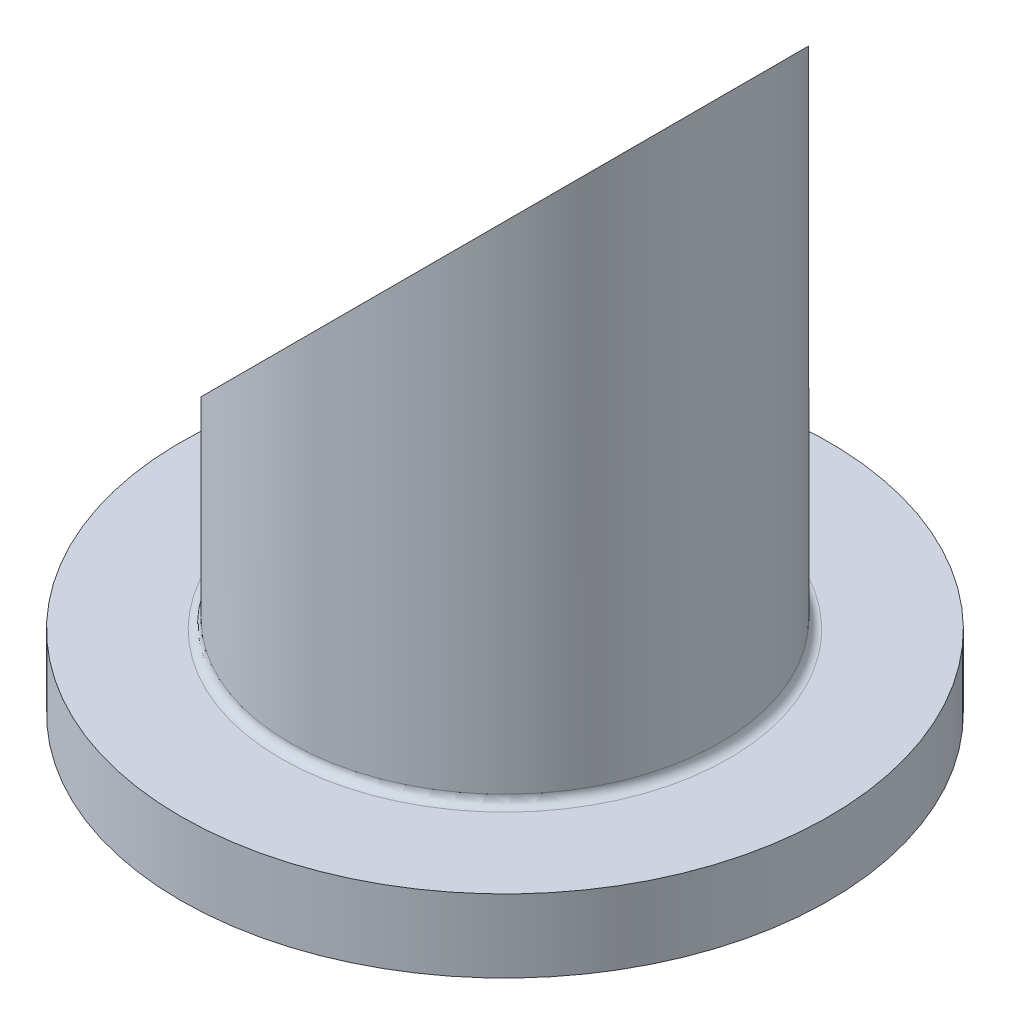
from build123d import *

# Parameters (mm, degrees)
SKETCH1_R               = 8.9
BOSS_EXTRUDE1_DEPTH     = 2
SKETCH2_R               = 5.9
BOSS_EXTRUDE2_DEPTH     = 20
CUT_EXTRUDE1_DEPTH      = 26.346005602
CUT_EXTRUDE1_DEPTH_BACK = 26.346005602
SKETCH4_W               = 2
SKETCH4_H               = 1
CUT_EXTRUDE2_DEPTH      = 1.2
FILLET1_R               = 0.25
FILLET2_R               = 0.25


with BuildPart() as part:
    # Sketch1 → Boss-Extrude1 (new body)
    with BuildSketch(Plane(origin=(0, 0, 0), x_dir=(1, 0, 0), z_dir=(0, 1, 0))):
        with Locations(Location((0, 0, 0), (0, 0, 270))):
            Circle(SKETCH1_R)
    extrude(amount=BOSS_EXTRUDE1_DEPTH)

    # Sketch2 → Boss-Extrude2 (add)
    with BuildSketch(Plane(origin=(0, 2, 0), x_dir=(1, 0, 0), z_dir=(0, 1, 0))):
        with Locations(Location((0, 0, 0), (0, 0, 270))):
            Circle(SKETCH2_R)
    extrude(amount=BOSS_EXTRUDE2_DEPTH)

    # Sketch3 → Cut-Extrude1 (cut, two sides: drawn at the far end of the back side and taken through both)
    with BuildSketch(Plane.XY.offset(-CUT_EXTRUDE1_DEPTH_BACK)):
        Polygon((-6.28, 5.42), (6.28, 17.98), (6.28, 28.771900514), (-6.28, 28.771900514), align=None)
    extrude(amount=CUT_EXTRUDE1_DEPTH + CUT_EXTRUDE1_DEPTH_BACK, mode=Mode.SUBTRACT)

    # Sketch4 → Cut-Extrude2 (cut)
    with BuildSketch(Plane.XZ):
        with Locations((4, 0)):
            Rectangle(SKETCH4_W, SKETCH4_H)
    extrude(amount=-CUT_EXTRUDE2_DEPTH, mode=Mode.SUBTRACT)

    # Fillet1
    fillet1_edges = [part.edges().sort_by_distance(p)[0] for p in [
        (3, 1.2, 0),
        (3, 0.6, -0.5),
        (4, 1.2, 0.5),
        (3, 0.6, 0.5),
        (5, 1.2, 0),
        (5, 0.6, 0.5),
        (4, 1.2, -0.5),
        (5, 0.6, -0.5),
        (3, 0, 0),
        (4, 0, -0.5),
        (5, 0, 0),
        (4, 0, 0.5),
    ]]
    fillet(fillet1_edges, radius=FILLET1_R)

    # Fillet2
    fillet2_edges = [part.edges().sort_by_distance(p)[0] for p in [
        (0, 2, -5.9),
    ]]
    fillet(fillet2_edges, radius=FILLET2_R)


solid = part.part
